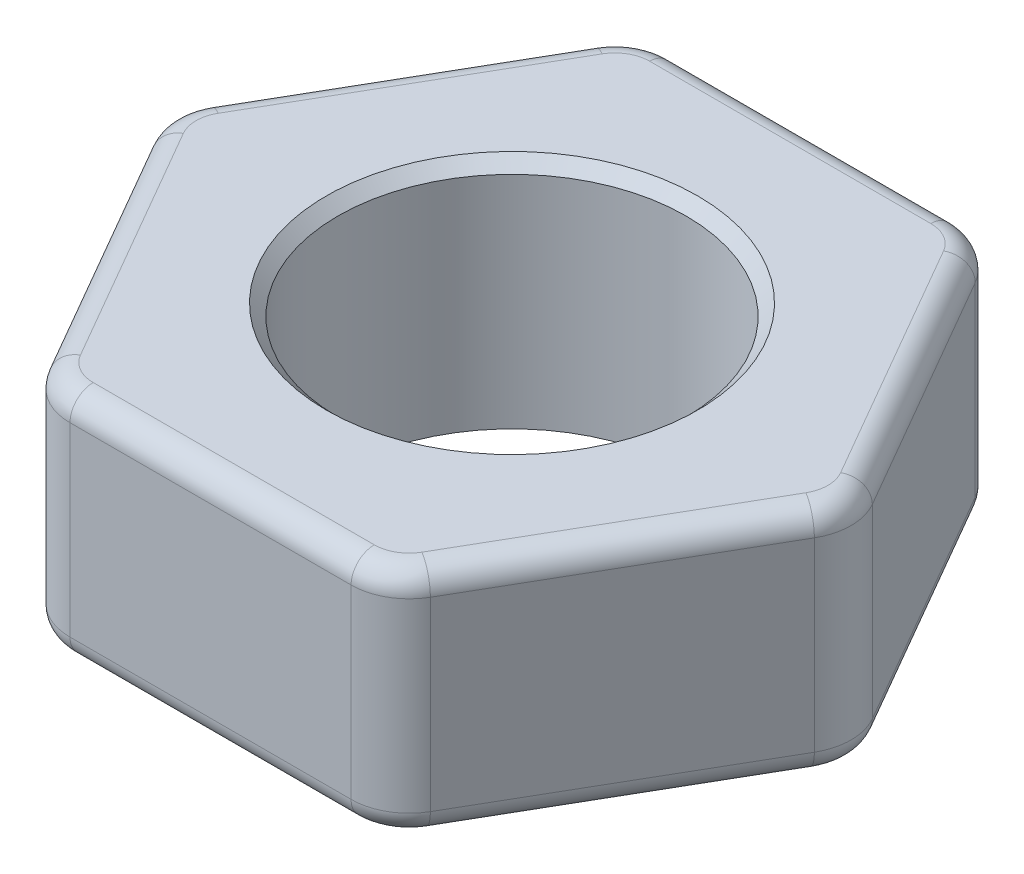
from build123d import *

# Parameters (mm, degrees)
BOSS_EXTRUDE1_DEPTH = 2
SKETCH2_R           = 1.5
CUT_EXTRUDE1_DEPTH  = 5.444097209
FILLET1_R           = 0.5
FILLET2_R           = 0.2
CHAMFER1_SIZE       = 0.1


with BuildPart() as part:
    # Sketch1 → Boss-Extrude1 (new body)
    with BuildSketch(Plane(origin=(0, 0, 0), x_dir=(1, 0, 0), z_dir=(0, 1, 0))):
        Polygon((3, 0), (1.5, 2.598076211), (-1.5, 2.598076211), (-3, 0), (-1.5, -2.598076211), (1.5, -2.598076211), align=None)
    extrude(amount=BOSS_EXTRUDE1_DEPTH)

    # Sketch2 → Cut-Extrude1 (cut, through all)
    with BuildSketch(Plane(origin=(0, 2, 0), x_dir=(1, 0, 0), z_dir=(0, 1, 0))):
        with Locations(Location((0, 0, 0), (0, 0, 270))):
            Circle(SKETCH2_R)
    extrude(amount=-CUT_EXTRUDE1_DEPTH, mode=Mode.SUBTRACT)

    # Fillet1
    fillet1_edges = [part.edges().sort_by_distance(p)[0] for p in [
        (1.5, 1, 2.598076211),
        (-1.5, 1, 2.598076211),
        (-3, 1, 0),
        (-1.5, 1, -2.598076211),
        (1.5, 1, -2.598076211),
        (3, 1, 0),
    ]]
    fillet(fillet1_edges, radius=FILLET1_R)

    # Fillet2
    fillet2_edges = [part.edges().sort_by_distance(p)[0] for p in [
        (0, 0, 2.598076211),
        (0, 2, 2.598076211),
        (2.25, 0, 1.299038106),
        (-2.25, 0, 1.299038106),
        (-2.25, 0, -1.299038106),
        (0, 0, -2.598076211),
        (2.25, 0, -1.299038106),
        (1.461324865, 0, 2.531088913),
        (2.922649731, 0, 0),
        (1.461324865, 0, -2.531088913),
        (-1.461324865, 0, -2.531088913),
        (-2.922649731, 0, 0),
        (-1.461324865, 0, 2.531088913),
        (-2.25, 2, 1.299038106),
        (2.25, 2, 1.299038106),
        (2.25, 2, -1.299038106),
        (0, 2, -2.598076211),
        (-2.25, 2, -1.299038106),
        (1.461324865, 2, 2.531088913),
        (2.922649731, 2, 0),
        (1.461324865, 2, -2.531088913),
        (-1.461324865, 2, -2.531088913),
        (-2.922649731, 2, 0),
        (-1.461324865, 2, 2.531088913),
    ]]
    fillet(fillet2_edges, radius=FILLET2_R)

    # Chamfer1
    chamfer1_edges = [part.edges().sort_by_distance(p)[0] for p in [
        (0, 2, -1.5),
    ]]
    chamfer(chamfer1_edges, length=CHAMFER1_SIZE)


solid = part.part
